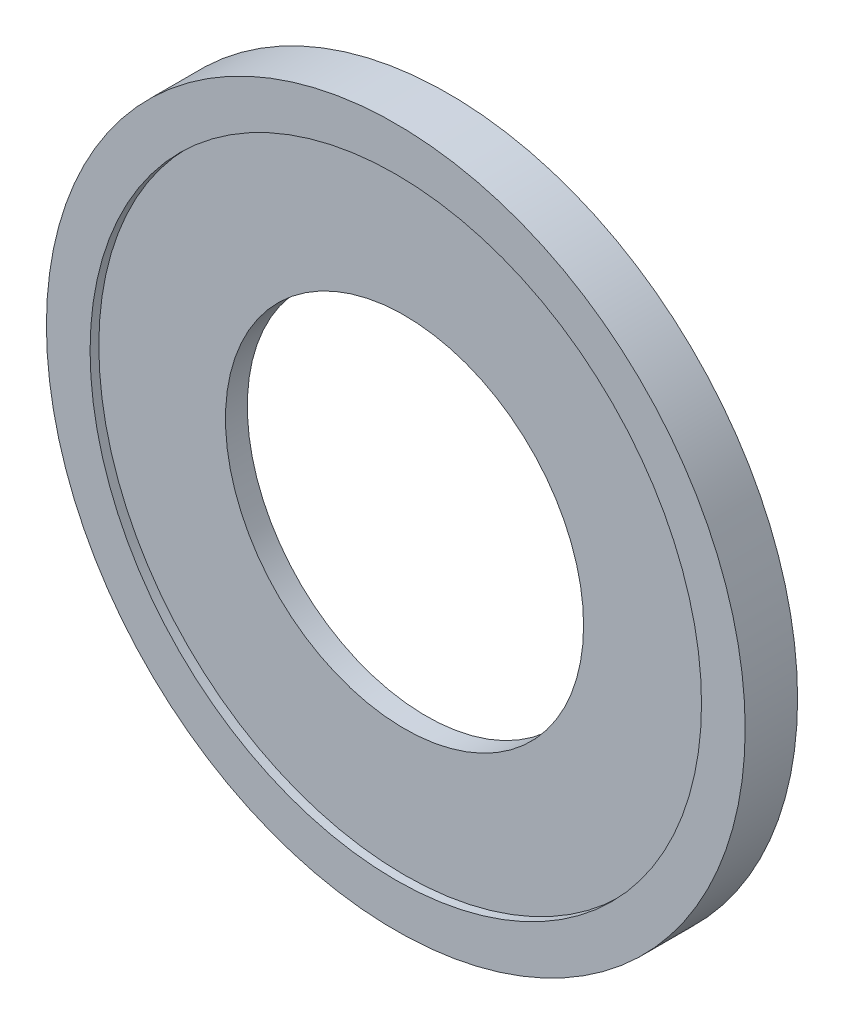
from build123d import *

# Parameters (mm, degrees)
OUTER_FLANGE_CONTACT_ANNULUS_ID8P2_START = 3
SKETCH1_R                                = 8
SKETCH1_R_2                              = 4.1
OUTER_FLANGE_CONTACT_ANNULUS_ID8P2_DEPTH = 0.5
M14X0P5_INTERNAL_THREAD_ENVELOPE_START   = 2.5
SKETCH2_R                                = 8
SKETCH2_R_2                              = 7
M14X0P5_INTERNAL_THREAD_ENVELOPE_DEPTH   = 1.2


with BuildPart() as part:
    # Sketch1 → Outer_Flange_Contact_Annulus_ID8p2 (new body)
    with BuildSketch(Plane.XY.offset(OUTER_FLANGE_CONTACT_ANNULUS_ID8P2_START)):
        Circle(SKETCH1_R)
        Circle(SKETCH1_R_2, mode=Mode.SUBTRACT)
    extrude(amount=OUTER_FLANGE_CONTACT_ANNULUS_ID8P2_DEPTH)

    # Sketch2 → M14x0p5_Internal_Thread_Envelope (add)
    with BuildSketch(Plane.XY.offset(M14X0P5_INTERNAL_THREAD_ENVELOPE_START)):
        Circle(SKETCH2_R)
        Circle(SKETCH2_R_2, mode=Mode.SUBTRACT)
    extrude(amount=M14X0P5_INTERNAL_THREAD_ENVELOPE_DEPTH)


solid = part.part
